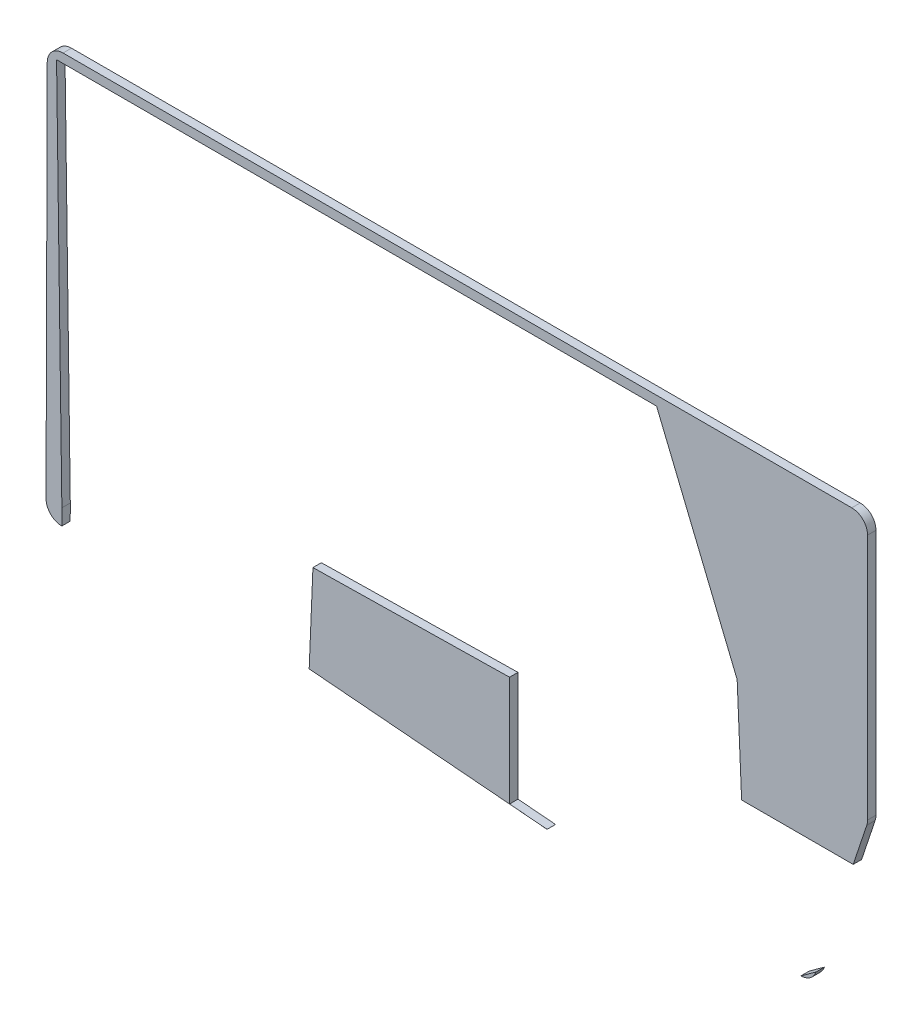
from build123d import *

# Parameters (mm, degrees)
BOSS_EXTRUDE1_DEPTH = 1.6
CUT_EXTRUDE1_DEPTH  = 308.157536942


with BuildPart() as part:
    # Model → Boss-Extrude1 (new body)
    with BuildSketch(Plane.XY):
        with BuildLine():
            Line((251.9480764, -89.4019249), (101.9884826, -89.4980837))
            ThreePointArc((101.9884826, -89.4980837), (99.871807019, -90.374045054), (98.9904216, -92.4884678))
            Line((98.9904216, -92.4884678), (98.7596462, -164.4903847))
            ThreePointArc((98.7596462, -164.4903847), (99.634913648, -166.617918097), (101.7596308, -167.5))
            Line((101.7596308, -167.5), (148.5292403, -167.5))
            ThreePointArc((148.5292403, -167.5), (148.654889304, -167.502632426), (148.7803178, -167.5105251))
            Line((148.7803178, -167.5105251), (193.7746822, -171.2894749))
            ThreePointArc((193.7746822, -171.2894749), (193.900110696, -171.297367574), (194.0257597, -171.3))
            Line((194.0257597, -171.3), (242.2877223, -171.3))
            ThreePointArc((242.2877223, -171.3), (244.041853134, -170.733726599), (245.1337722, -169.2486834))
            Line((245.1337722, -169.2486834), (254.7960499, -140.2618504))
            ThreePointArc((254.7960499, -140.2618504), (254.911262384, -139.79371378), (254.95, -139.313167))
            Line((254.95, -139.313167), (254.95, -92.4019243))
            ThreePointArc((254.95, -92.4019243), (254.070640145, -90.279923959), (251.9480764, -89.4019249))
        make_face()
    extrude(amount=BOSS_EXTRUDE1_DEPTH)

    # Sketch3 → Cut-Extrude1 (cut, through all)
    with BuildSketch(Plane.XY.offset(1.6)):
        Polygon((100.760916, -91.211362), (214.836347171, -91.211362), (230.158545553, -128.574226947), (231.007722728, -147.98399094), (252.231178861, -147.98399094), (245.1337722, -169.2486834), (242.2877223, -171.3), (194.0257597, -171.3), (186.88878022, -170.705009504), (186.88878022, -149.824825818), (149.504627314, -150.462797195), (148.791233999, -167.505304017), (101.7596308, -167.5), (101.770547, -164.494778897), align=None)
    extrude(amount=-CUT_EXTRUDE1_DEPTH, mode=Mode.SUBTRACT)


with BuildPart() as cut_extrude1_piece_1:
    # of the separate pieces the step leaves, piece 1, a body of its own (cut_extrude1_pieces)
    add(part.part.solids().sort_by_distance((251.9480764, -89.4019249, 0))[0])


with BuildPart() as cut_extrude1_piece_2:
    # of the separate pieces the step leaves, piece 2, a body of its own (cut_extrude1_pieces)
    add(part.part.solids().sort_by_distance((148.791233999, -167.505304017, 0))[0])


with BuildPart() as cut_extrude1_piece_3:
    # of the separate pieces the step leaves, piece 3, a body of its own (cut_extrude1_pieces)
    add(part.part.solids().sort_by_distance((242.2877223, -171.3, 0))[0])


solid = Compound([cut_extrude1_piece_1.part, cut_extrude1_piece_2.part, cut_extrude1_piece_3.part])
